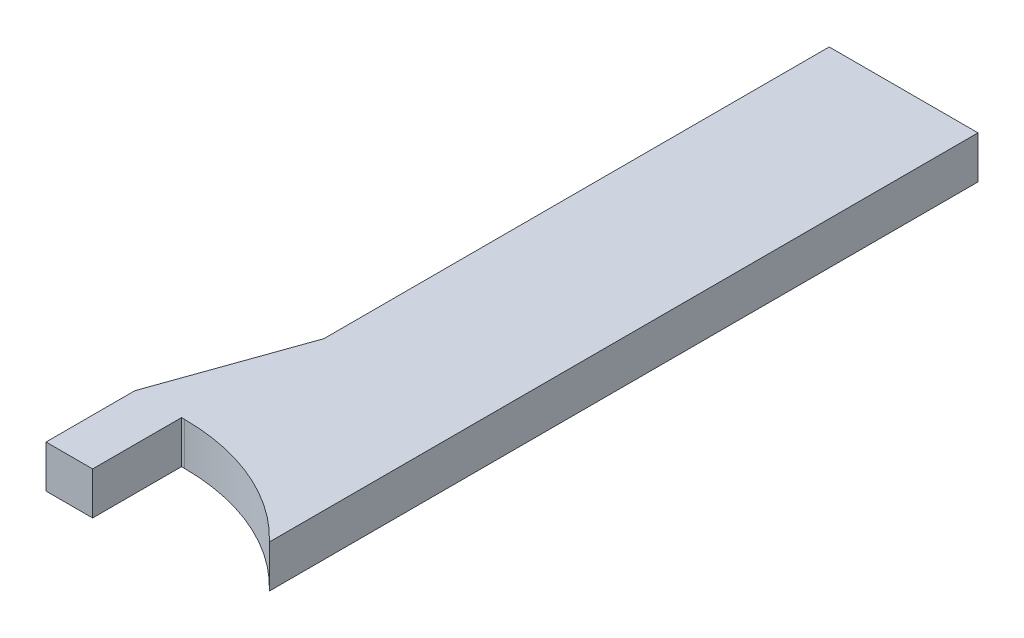
from build123d import *

# Parameters (mm, degrees)
EXTRUDE_1_DEPTH = 3
SKETCH_2_W      = 3.288983057
SKETCH_2_H      = 6.272081599
EXTRUDE_2_DEPTH = 3
SKETCH_3_W      = 10.5
SKETCH_3_H      = 28.238150406
EXTRUDE_3_DEPTH = 3


with BuildPart() as part:
    # 草图1 → 凸台-拉伸1 (new body)
    with BuildSketch(Plane(origin=(0, 0, 0), x_dir=(1, 0, 0), z_dir=(0, 1, 0))):
        with BuildLine():
            ThreePointArc((0, 14.5), (5.711829829, 13.327602935), (10.5, 10))
            Line((10.5, 10), (10.5, 31.761849594))
            Line((10.5, 31.761849594), (0, 31.761849594))
            Line((0, 31.761849594), (0, 14.5))
        make_face()
    extrude(amount=EXTRUDE_1_DEPTH)

    # 草图2 → 凸台-拉伸2 (add)
    with BuildSketch(Plane(origin=(0, 3, 0), x_dir=(1, 0, 0), z_dir=(0, 1, 0))):
        Polygon((-0.2, 14.5), (0, 14.5), (0, 24.347174928), (-3.488983057, 14.5), align=None)
        with Locations((-1.844491529, 11.363959201)):
            Rectangle(SKETCH_2_W, SKETCH_2_H)
    extrude(amount=-EXTRUDE_2_DEPTH)

    # 草图3 → 凸台-拉伸3 (add)
    with BuildSketch(Plane(origin=(0, 3, 0), x_dir=(1, 0, 0), z_dir=(0, 1, 0))):
        with Locations((5.25, 45.880924797)):
            Rectangle(SKETCH_3_W, SKETCH_3_H)
    extrude(amount=-EXTRUDE_3_DEPTH)


solid = part.part
